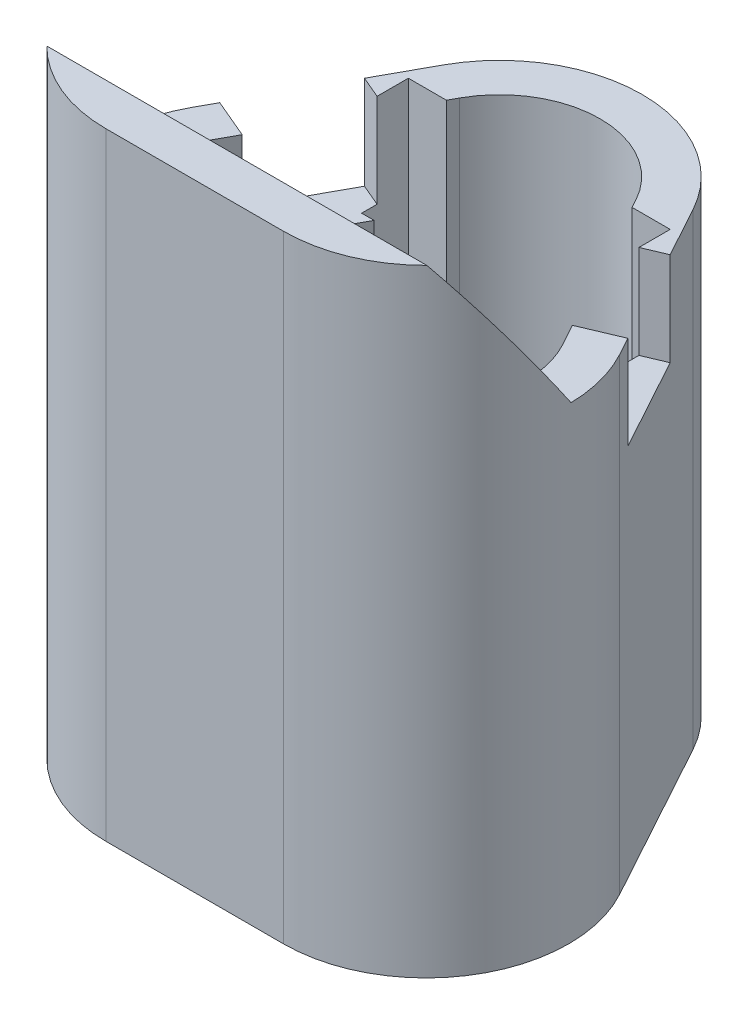
from build123d import *

# Parameters (mm, degrees)
RESSALTO_EXTRUS_O1_DEPTH   = 66
CORTE_EXTRUS_O1_DEPTH      = 53.5
CORTE_EXTRUS_O2_DEPTH      = 63
CORTE_EXTRUS_O3_DEPTH      = 75.455375226
CORTE_EXTRUS_O3_DEPTH_BACK = 75.455375226
CORTE_EXTRUS_O4_DEPTH      = 61.725636267
CORTE_EXTRUS_O4_DEPTH_BACK = 61.725636267
ESBO_O5_W                  = 2
ESBO_O5_H                  = 8
CORTE_EXTRUS_O5_DEPTH      = 47
CORTE_EXTRUS_O7_DEPTH      = 10


with BuildPart() as part:
    # Esboço1 → Ressalto-extrusão1 (new body)
    with BuildSketch(Plane(origin=(0, 0, 0), x_dir=(1, 0, 0), z_dir=(0, 1, 0))):
        with BuildLine():
            Line((-13.376104721, 16.054091922), (-22.876104721, -1.295908078))
            ThreePointArc((-22.876104721, -1.295908078), (-22.619735169, -16.393998269), (-9.5, -23.87))
            Line((-9.5, -23.87), (9.5, -23.87))
            ThreePointArc((9.5, -23.87), (22.619735169, -16.393998269), (22.876104721, -1.295908078))
            Line((22.876104721, -1.295908078), (13.376104721, 16.054091922))
            ThreePointArc((13.376104721, 16.054091922), (0, 23.98), (-13.376104721, 16.054091922))
        make_face()
    extrude(amount=RESSALTO_EXTRUS_O1_DEPTH)

    # Esboço2 → Corte-extrusão1 (cut)
    with BuildSketch(Plane(origin=(0, 66, 0), x_dir=(1, 0, 0), z_dir=(0, 1, 0))):
        with BuildLine():
            Line((-18.929057426, -3.45711553), (-9.429057426, 13.89288447))
            ThreePointArc((-9.429057426, 13.89288447), (0, 19.48), (9.429057426, 13.89288447))
            Line((9.429057426, 13.89288447), (18.929057426, -3.45711553))
            ThreePointArc((18.929057426, -3.45711553), (18.748337906, -14.100031567), (9.5, -19.37))
            Line((9.5, -19.37), (-9.5, -19.37))
            ThreePointArc((-9.5, -19.37), (-18.748337906, -14.100031567), (-18.929057426, -3.45711553))
        make_face()
    extrude(amount=-CORTE_EXTRUS_O1_DEPTH, mode=Mode.SUBTRACT)

    # Esboço3 → Corte-extrusão2 (cut)
    with BuildSketch(Plane(origin=(0, 66, 0), x_dir=(1, 0, 0), z_dir=(0, 1, 0))):
        with BuildLine():
            Line((0, -3.37), (18.88135728, -3.37))
            Line((18.88135728, -3.37), (9.429057426, 13.89288447))
            ThreePointArc((9.429057426, 13.89288447), (0, 19.48), (-9.429057426, 13.89288447))
            Line((-9.429057426, 13.89288447), (-18.88135728, -3.37))
            Line((-18.88135728, -3.37), (0, -3.37))
        make_face()
    extrude(amount=-CORTE_EXTRUS_O2_DEPTH, mode=Mode.SUBTRACT)

    # Esboço4 → Corte-extrusão3 (cut, two sides: drawn at the far end of the back side and taken through both)
    with BuildSketch(Plane(origin=(0, 0, 0), x_dir=(0, 0, -1), z_dir=(1, 0, 0)).offset(-CORTE_EXTRUS_O3_DEPTH_BACK)):
        Polygon((-8.37, 50), (35.337515561, 50), (33.498972566, 68.632714226), (-19.37, 68.632714226), (-19.37, 66), align=None)
    extrude(amount=CORTE_EXTRUS_O3_DEPTH + CORTE_EXTRUS_O3_DEPTH_BACK, mode=Mode.SUBTRACT)

    # Esboço5 → Corte-extrusão4 (cut, two sides: drawn at the far end of the back side and taken through both)
    with BuildSketch(Plane(origin=(0, 50, 0), x_dir=(1, 0, 0), z_dir=(0, 1, 0)).offset(-CORTE_EXTRUS_O4_DEPTH_BACK)):
        with Locations((6, 7.13)):
            Rectangle(ESBO_O5_W, ESBO_O5_H)
        with Locations((-6, 7.13)):
            Rectangle(ESBO_O5_W, ESBO_O5_H)
    extrude(amount=CORTE_EXTRUS_O4_DEPTH + CORTE_EXTRUS_O4_DEPTH_BACK, mode=Mode.SUBTRACT)

    # Esboço6 → Corte-extrusão5 (cut)
    with BuildSketch(Plane(origin=(0, 50, 0), x_dir=(1, 0, 0), z_dir=(0, 1, 0))):
        Polygon((0, 12.98), (14, 12.98), (14, 7.98), (-14, 7.98), (-14, 12.98), align=None)
    extrude(amount=-CORTE_EXTRUS_O5_DEPTH, mode=Mode.SUBTRACT)

    # Esboço7 → Corte-extrusão7 (cut)
    with BuildSketch(Plane(origin=(0, 50, 0), x_dir=(1, 0, 0), z_dir=(0, 1, 0))):
        Polygon((0, 3.70102494), (16.346068598, 10.63), (21.821572921, 0.63), (0, -8.62), (-21.821572921, 0.63), (-16.346068598, 10.63), align=None)
    extrude(amount=-CORTE_EXTRUS_O7_DEPTH, mode=Mode.SUBTRACT)


solid = part.part
